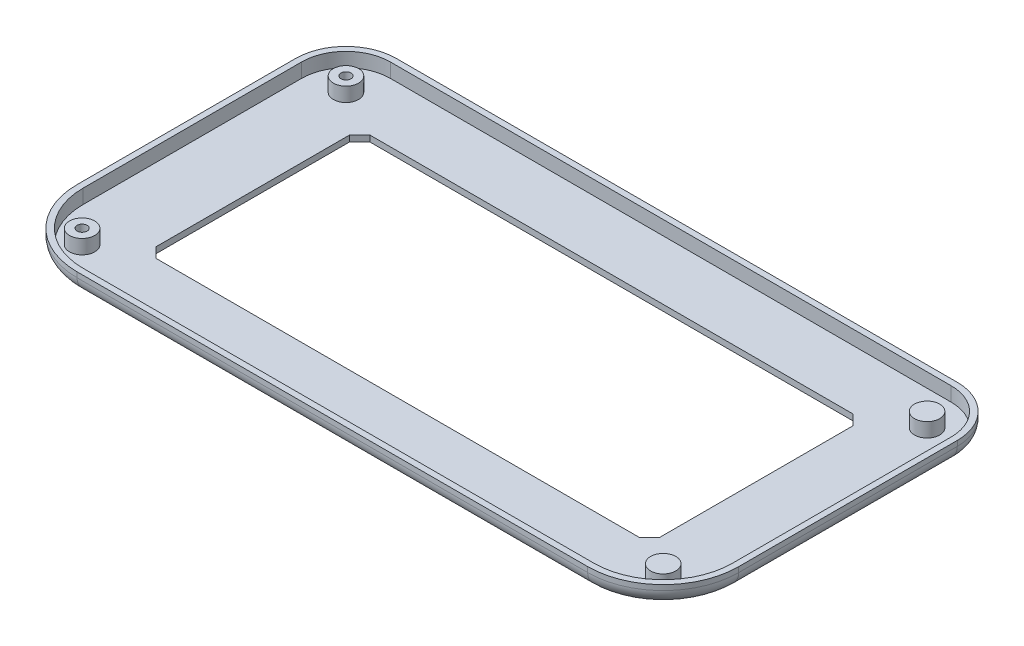
from build123d import *

# Parameters (mm, degrees)
ESBO_O1_W                    = 131.4
ESBO_O1_H                    = 68.4
BASE_DEPTH                   = 1.2
FILETE1_R                    = 15
FILETE2_R                    = 15
FILETE3_R                    = 10
FILETE4_R                    = 10
PAREDES_START                = 10
PAREDES_DEPTH                = 10
FILETE_DA_BASE_R             = 3
ESBO_O6_R                    = 2.5
SUPORTE_DOS_PARAFUSOS_DEPTH  = 10
ESBO_O7_R                    = 1
FURO_PARA_OS_PARAFUSOS_DEPTH = 6
ESBO_O8_W                    = 100
ESBO_O8_H                    = 42.449361702
CORTE_EXTRUS_O1_DEPTH        = 10
ESBO_O9_W                    = 134.994270452
ESBO_O9_H                    = 14.346821692
CORTE_EXTRUS_O2_DEPTH        = 96.501256536
CHANFRO8_SIZE                = 2
CHANFRO9_SIZE                = 2
CHANFRO10_SIZE               = 2
CHANFRO11_SIZE               = 2
ESBO_O10_R                   = 1
CORTE_EXTRUS_O4_DEPTH        = 2


with BuildPart() as part:
    # Esboço1 → Base (new body)
    with BuildSketch(Plane(origin=(0, 0, 0), x_dir=(1, 0, 0), z_dir=(0, 1, 0))):
        Rectangle(ESBO_O1_W, ESBO_O1_H)
    extrude(amount=BASE_DEPTH)

    # Filete1
    filete1_edges = [part.edges().sort_by_distance(p)[0] for p in [
        (65.7, 0.6, 34.2),
    ]]
    fillet(filete1_edges, radius=FILETE1_R)

    # Filete2
    filete2_edges = [part.edges().sort_by_distance(p)[0] for p in [
        (-65.7, 0.6, 34.2),
    ]]
    fillet(filete2_edges, radius=FILETE2_R)

    # Filete3
    filete3_edges = [part.edges().sort_by_distance(p)[0] for p in [
        (65.7, 0.6, -34.2),
    ]]
    fillet(filete3_edges, radius=FILETE3_R)

    # Filete4
    filete4_edges = [part.edges().sort_by_distance(p)[0] for p in [
        (-65.7, 0.6, -34.2),
    ]]
    fillet(filete4_edges, radius=FILETE4_R)

    # Esboço5 → Paredes (add)
    with BuildSketch(Plane(origin=(0, 1.2, 0), x_dir=(1, 0, 0), z_dir=(0, 1, 0)).offset(PAREDES_START)):
        with BuildLine():
            Line((55.7, 34.2), (-55.7, 34.2))
            ThreePointArc((-55.7, 34.2), (-62.771067812, 31.271067812), (-65.7, 24.2))
            Line((-65.7, 24.2), (-65.7, -19.2))
            ThreePointArc((-65.7, -19.2), (-61.306601718, -29.806601718), (-50.7, -34.2))
            Line((-50.7, -34.2), (50.7, -34.2))
            ThreePointArc((50.7, -34.2), (61.306601718, -29.806601718), (65.7, -19.2))
            Line((65.7, -19.2), (65.7, 24.2))
            ThreePointArc((65.7, 24.2), (62.771067812, 31.271067812), (55.7, 34.2))
        make_face()
        with BuildLine():
            Line((55.7, 33), (-55.7, 33))
            ThreePointArc((-55.7, 33), (-61.922539674, 30.422539674), (-64.5, 24.2))
            Line((-64.5, 24.2), (-64.5, -19.2))
            ThreePointArc((-64.5, -19.2), (-60.45807358, -28.95807358), (-50.7, -33))
            Line((-50.7, -33), (50.7, -33))
            ThreePointArc((50.7, -33), (60.45807358, -28.95807358), (64.5, -19.2))
            Line((64.5, -19.2), (64.5, 24.2))
            ThreePointArc((64.5, 24.2), (61.922539674, 30.422539674), (55.7, 33))
        make_face(mode=Mode.SUBTRACT)
    extrude(amount=-PAREDES_DEPTH)

    # Filete da base
    filete_da_base_edges = [part.edges().sort_by_distance(p)[0] for p in [
        (65.7, 0, -2.5),
        (61.306601718, 0, 29.806601718),
        (0, 0, 34.2),
        (-61.306601718, 0, 29.806601718),
        (0, 0, -34.2),
        (62.771067812, 0, -31.271067812),
        (-65.7, 0, -2.5),
        (-62.771067812, 0, -31.271067812),
    ]]
    fillet(filete_da_base_edges, radius=FILETE_DA_BASE_R)

    # Esboço6 → Suporte dos parafusos (add)
    with BuildSketch(Plane(origin=(0, 1.2, 0), x_dir=(1, 0, 0), z_dir=(0, 1, 0))):
        with Locations(Location((-57.7, 26.2, 0), (0, 0, 90))):
            Circle(ESBO_O6_R)
        with Locations(Location((-57.7, -26.2, 0), (0, 0, 90))):
            Circle(ESBO_O6_R)
        with Locations(Location((57.7, 26.2, 0), (0, 0, 90))):
            Circle(ESBO_O6_R)
        with Locations(Location((57.7, -26.2, 0), (0, 0, 90))):
            Circle(ESBO_O6_R)
    extrude(amount=SUPORTE_DOS_PARAFUSOS_DEPTH)

    # Esboço7 → Furo para os parafusos (cut)
    with BuildSketch(Plane(origin=(0, 11.2, 0), x_dir=(1, 0, 0), z_dir=(0, 1, 0))):
        with Locations(Location((-57.7, 26.2, 0), (0, 0, 270))):
            Circle(ESBO_O7_R)
        with Locations(Location((-57.7, -26.2, 0), (0, 0, 270))):
            Circle(ESBO_O7_R)
        with Locations(Location((57.7, -26.2, 0), (0, 0, 270))):
            Circle(ESBO_O7_R)
        with Locations(Location((57.7, 26.2, 0), (0, 0, 270))):
            Circle(ESBO_O7_R)
    extrude(amount=-FURO_PARA_OS_PARAFUSOS_DEPTH, mode=Mode.SUBTRACT)

    # Esboço8 → Corte-extrusão1 (cut)
    with BuildSketch(Plane(origin=(0, 1.2, 0), x_dir=(1, 0, 0), z_dir=(0, 1, 0))):
        Rectangle(ESBO_O8_W, ESBO_O8_H)
    extrude(amount=-CORTE_EXTRUS_O1_DEPTH, mode=Mode.SUBTRACT)

    # Esboço9 → Corte-extrusão2 (cut, through all)
    with BuildSketch(Plane.XY.offset(34.2)):
        with Locations((0, 11.2)):
            Rectangle(ESBO_O9_W, ESBO_O9_H)
    extrude(amount=-CORTE_EXTRUS_O2_DEPTH, mode=Mode.SUBTRACT)

    # Chanfro8
    chanfro8_edges = [part.edges().sort_by_distance(p)[0] for p in [
        (-50, 0.6, -21.224680851),
    ]]
    chamfer(chanfro8_edges, length=CHANFRO8_SIZE)

    # Chanfro9
    chanfro9_edges = [part.edges().sort_by_distance(p)[0] for p in [
        (50, 0.6, -21.224680851),
    ]]
    chamfer(chanfro9_edges, length=CHANFRO9_SIZE)

    # Chanfro10
    chanfro10_edges = [part.edges().sort_by_distance(p)[0] for p in [
        (50, 0.6, 21.224680851),
    ]]
    chamfer(chanfro10_edges, length=CHANFRO10_SIZE)

    # Chanfro11
    chanfro11_edges = [part.edges().sort_by_distance(p)[0] for p in [
        (-50, 0.6, 21.224680851),
    ]]
    chamfer(chanfro11_edges, length=CHANFRO11_SIZE)

    # Esboço10 → Corte-extrusão4 (cut)
    with BuildSketch(Plane(origin=(0, 4.026589154, 0), x_dir=(1, 0, 0), z_dir=(0, 1, 0))):
        with Locations(Location((-57.7, 26.2, 0), (0, 0, 270))):
            Circle(ESBO_O10_R)
        with Locations(Location((-57.7, -26.2, 0), (0, 0, 270))):
            Circle(ESBO_O10_R)
    extrude(amount=-CORTE_EXTRUS_O4_DEPTH, mode=Mode.SUBTRACT)


solid = part.part
